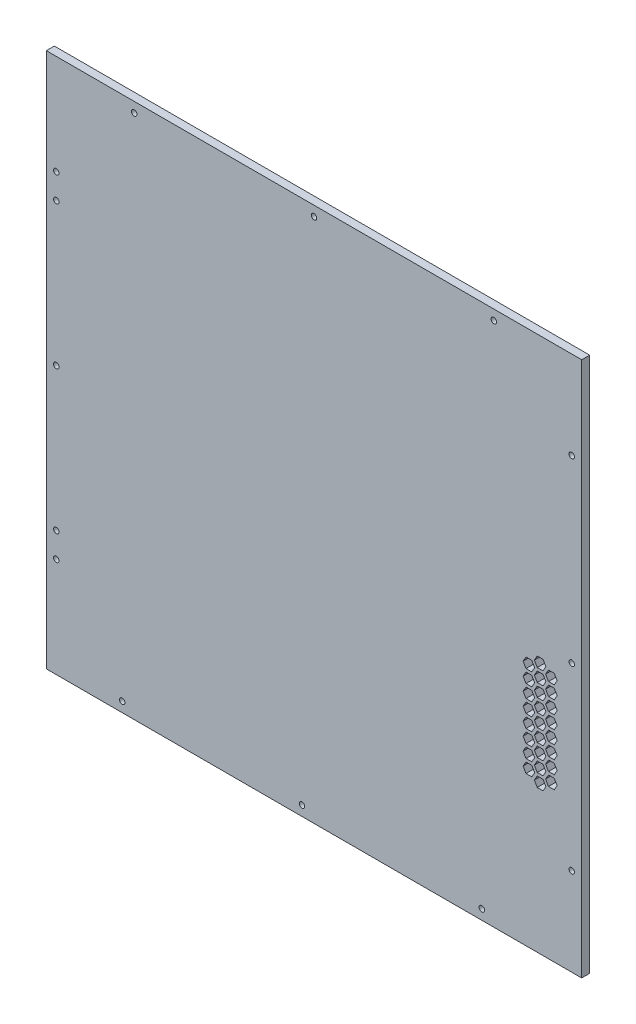
from build123d import *

# Parameters (mm, degrees)
SKETCH1_W           = 536
SKETCH1_H           = 536
SKETCH1_R           = 2.75
SKETCH1_R_2         = 2.749999922
SKETCH1_R_3         = 2.749999896
BOSS_EXTRUDE1_DEPTH = 8
CUT_EXTRUDE4_DEPTH  = 10


with BuildPart() as part:
    # Sketch1 → Boss-Extrude1 (new body)
    with BuildSketch(Plane.XY):
        Rectangle(SKETCH1_W, SKETCH1_H)
        with Locations((0, 258)):
            Circle(SKETCH1_R, mode=Mode.SUBTRACT)
        with Locations((-180, 258)):
            Circle(SKETCH1_R, mode=Mode.SUBTRACT)
        with Locations((180, 258)):
            Circle(SKETCH1_R, mode=Mode.SUBTRACT)
        with Locations((258, 7.8072e-05)):
            Circle(SKETCH1_R, mode=Mode.SUBTRACT)
        with Locations((258, 180.000078072)):
            Circle(SKETCH1_R, mode=Mode.SUBTRACT)
        with Locations((258, -179.999921928)):
            Circle(SKETCH1_R, mode=Mode.SUBTRACT)
        with Locations((-12.009451925, -258)):
            Circle(SKETCH1_R, mode=Mode.SUBTRACT)
        with Locations((167.990548075, -258)):
            Circle(SKETCH1_R, mode=Mode.SUBTRACT)
        with Locations((-192.009451925, -258)):
            Circle(SKETCH1_R, mode=Mode.SUBTRACT)
        with Locations((-257.999921928, 7.8072e-05)):
            Circle(SKETCH1_R, mode=Mode.SUBTRACT)
        with Locations((-257.999921928, -167.990470003)):
            Circle(SKETCH1_R, mode=Mode.SUBTRACT)
        with Locations((-257.999921928, 168.009529997)):
            Circle(SKETCH1_R, mode=Mode.SUBTRACT)
        with Locations((-257.999921928, 143.009529997)):
            Circle(SKETCH1_R_2, mode=Mode.SUBTRACT)
        with Locations((-257.999921928, -142.990471748)):
            Circle(SKETCH1_R_3, mode=Mode.SUBTRACT)
    extrude(amount=BOSS_EXTRUDE1_DEPTH)

    # Sketch3 → Cut-Extrude4 (cut)
    with BuildSketch(Plane.XY.offset(8)):
        Polygon((243.398526366, -22.587571342), (240.511775021, -17.587571342), (234.738272329, -17.587571342), (231.851520983, -22.587571342), (234.738272329, -27.587571342), (240.511775021, -27.587571342), align=None)
        Polygon((220.881865868, -22.587571342), (217.995114522, -17.587571342), (212.22161183, -17.587571342), (209.334860484, -22.587571342), (212.22161183, -27.587571342), (217.995114522, -27.587571342), align=None)
        Polygon((232.140196117, -29.087571342), (229.253444771, -24.087571342), (223.479942079, -24.087571342), (220.593190733, -29.087571342), (223.479942079, -34.087571342), (229.253444771, -34.087571342), align=None)
        Polygon((232.140196117, -16.087571342), (229.253444771, -11.087571342), (223.479942079, -11.087571342), (220.593190733, -16.087571342), (223.479942079, -21.087571342), (229.253444771, -21.087571342), align=None)
        Polygon((243.398526366, -35.587571342), (240.511775021, -30.587571342), (234.738272329, -30.587571342), (231.851520983, -35.587571342), (234.738272329, -40.587571342), (240.511775021, -40.587571342), align=None)
        Polygon((220.881865868, -35.587571342), (217.995114522, -30.587571342), (212.22161183, -30.587571342), (209.334860484, -35.587571342), (212.22161183, -40.587571342), (217.995114522, -40.587571342), align=None)
        Polygon((232.140196117, -42.087571342), (229.253444771, -37.087571342), (223.479942079, -37.087571342), (220.593190733, -42.087571342), (223.479942079, -47.087571342), (229.253444771, -47.087571342), align=None)
        Polygon((243.398526366, -48.587571342), (240.511775021, -43.587571342), (234.738272329, -43.587571342), (231.851520983, -48.587571342), (234.738272329, -53.587571342), (240.511775021, -53.587571342), align=None)
        Polygon((220.881865868, -48.587571342), (217.995114522, -43.587571342), (212.22161183, -43.587571342), (209.334860484, -48.587571342), (212.22161183, -53.587571342), (217.995114522, -53.587571342), align=None)
        Polygon((232.140196117, -55.087571342), (229.253444771, -50.087571342), (223.479942079, -50.087571342), (220.593190733, -55.087571342), (223.479942079, -60.087571342), (229.253444771, -60.087571342), align=None)
        Polygon((243.398526366, -61.587571342), (240.511775021, -56.587571342), (234.738272329, -56.587571342), (231.851520983, -61.587571342), (234.738272329, -66.587571342), (240.511775021, -66.587571342), align=None)
        Polygon((220.881865868, -61.587571342), (217.995114522, -56.587571342), (212.22161183, -56.587571342), (209.334860484, -61.587571342), (212.22161183, -66.587571342), (217.995114522, -66.587571342), align=None)
        Polygon((232.140196117, -68.087571342), (229.253444771, -63.087571342), (223.479942079, -63.087571342), (220.593190733, -68.087571342), (223.479942079, -73.087571342), (229.253444771, -73.087571342), align=None)
        Polygon((243.398526366, -74.587571342), (240.511775021, -69.587571342), (234.738272329, -69.587571342), (231.851520983, -74.587571342), (234.738272329, -79.587571342), (240.511775021, -79.587571342), align=None)
        Polygon((220.881865868, -74.587571342), (217.995114522, -69.587571342), (212.22161183, -69.587571342), (209.334860484, -74.587571342), (212.22161183, -79.587571342), (217.995114522, -79.587571342), align=None)
        Polygon((232.140196117, -81.087571342), (229.253444771, -76.087571342), (223.479942079, -76.087571342), (220.593190733, -81.087571342), (223.479942079, -86.087571342), (229.253444771, -86.087571342), align=None)
        Polygon((243.398526366, -87.587571342), (240.511775021, -82.587571342), (234.738272329, -82.587571342), (231.851520983, -87.587571342), (234.738272329, -92.587571342), (240.511775021, -92.587571342), align=None)
        Polygon((220.881865868, -87.587571342), (217.995114522, -82.587571342), (212.22161183, -82.587571342), (209.334860484, -87.587571342), (212.22161183, -92.587571342), (217.995114522, -92.587571342), align=None)
        Polygon((232.140196117, -94.087571342), (229.253444771, -89.087571342), (223.479942079, -89.087571342), (220.593190733, -94.087571342), (223.479942079, -99.087571342), (229.253444771, -99.087571342), align=None)
        Polygon((243.398526366, -100.587571342), (240.511775021, -95.587571342), (234.738272329, -95.587571342), (231.851520983, -100.587571342), (234.738272329, -105.587571342), (240.511775021, -105.587571342), align=None)
        Polygon((220.881865868, -100.587571342), (217.995114522, -95.587571342), (212.22161183, -95.587571342), (209.334860484, -100.587571342), (212.22161183, -105.587571342), (217.995114522, -105.587571342), align=None)
        Polygon((232.140196117, -107.087571342), (229.253444771, -102.087571342), (223.479942079, -102.087571342), (220.593190733, -107.087571342), (223.479942079, -112.087571342), (229.253444771, -112.087571342), align=None)
        Polygon((243.398526366, -113.587571342), (240.511775021, -108.587571342), (234.738272329, -108.587571342), (231.851520983, -113.587571342), (234.738272329, -118.587571342), (240.511775021, -118.587571342), align=None)
        Polygon((220.881865868, -113.587571342), (217.995114522, -108.587571342), (212.22161183, -108.587571342), (209.334860484, -113.587571342), (212.22161183, -118.587571342), (217.995114522, -118.587571342), align=None)
        Polygon((232.140196117, -120.087571342), (229.253444771, -115.087571342), (223.479942079, -115.087571342), (220.593190733, -120.087571342), (223.479942079, -125.087571342), (229.253444771, -125.087571342), align=None)
    extrude(amount=-CUT_EXTRUDE4_DEPTH, mode=Mode.SUBTRACT)


solid = part.part
